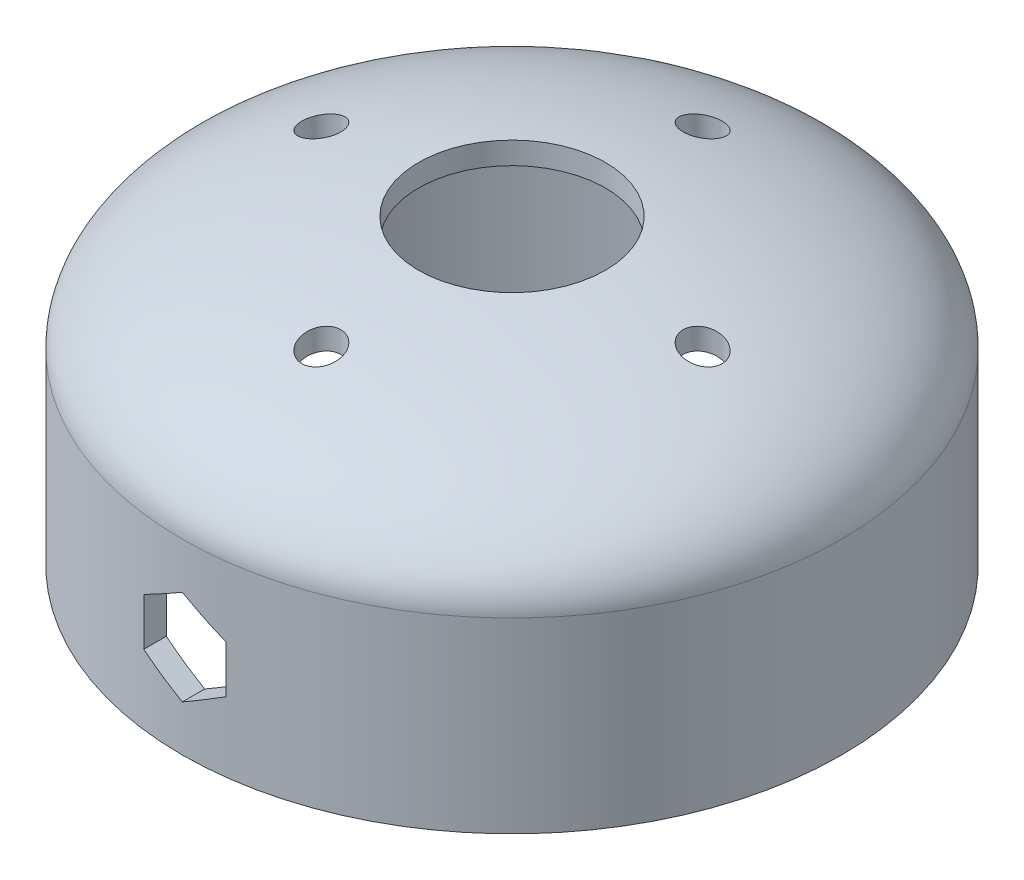
from build123d import *

# Parameters (mm, degrees)
SKETCH2_R               = 2.6
SKETCH2_R_2             = 12.5
CUT_EXTRUDE2_DEPTH      = 75.636586376
CUT_EXTRUDE4_DEPTH      = 75.2781452
CUT_EXTRUDE4_DEPTH_BACK = 75.2781452


with BuildPart() as part:
    # Sketch1 → Revolve1 (revolve)
    with BuildSketch(Plane.XY):
        with BuildLine():
            Line((41.1, 0), (41.1, 25))
            add(Edge.make_bspline(
                [(41.1, 25), (41.1, 38), (0, 38)],
                knots=[0, 0, 0, 1.570796327, 1.570796327, 1.570796327], degree=2, weights=[1, 0.707106781, 1]))
            Line((0, 38), (0, 41))
            add(Edge.make_bspline(
                [(44.1, 25), (44.1, 41), (0, 41)],
                knots=[0, 0, 0, 1.570796327, 1.570796327, 1.570796327], degree=2, weights=[1, 0.707106781, 1]))
            Line((44.1, 25), (44.1, 0))
            Line((44.1, 0), (41.1, 0))
        make_face()
    revolve(axis=Axis((0, 38, 0), (0, 1, 0)))

    # Sketch2 → Cut-Extrude2 (cut, through all)
    with BuildSketch(Plane(origin=(0, 0, 0), x_dir=(1, 0, 0), z_dir=(0, 1, 0))):
        with Locations((25.5, 0)):
            Circle(SKETCH2_R)
        with Locations(Location((0, -25.5, 0), (0, 0, 90))):
            Circle(SKETCH2_R)
        with Locations(Location((-25.5, 0, 0), (0, 0, 90))):
            Circle(SKETCH2_R)
        with Locations(Location((0, 25.5, 0), (0, 0, 90))):
            Circle(SKETCH2_R)
        Circle(SKETCH2_R_2)
    extrude(amount=CUT_EXTRUDE2_DEPTH, mode=Mode.SUBTRACT)

    # Sketch3 → Cut-Extrude4 (cut, two sides: drawn at the far end of the back side and taken through both)
    with BuildSketch(Plane.XY.offset(-CUT_EXTRUDE4_DEPTH_BACK)):
        Polygon((0, 18.850852961), (-5.5, 15.675426481), (-5.5, 9.324573519), (0, 6.149147039), (5.5, 9.324573519), (5.5, 15.675426481), align=None)
    extrude(amount=CUT_EXTRUDE4_DEPTH + CUT_EXTRUDE4_DEPTH_BACK, mode=Mode.SUBTRACT)


solid = part.part
